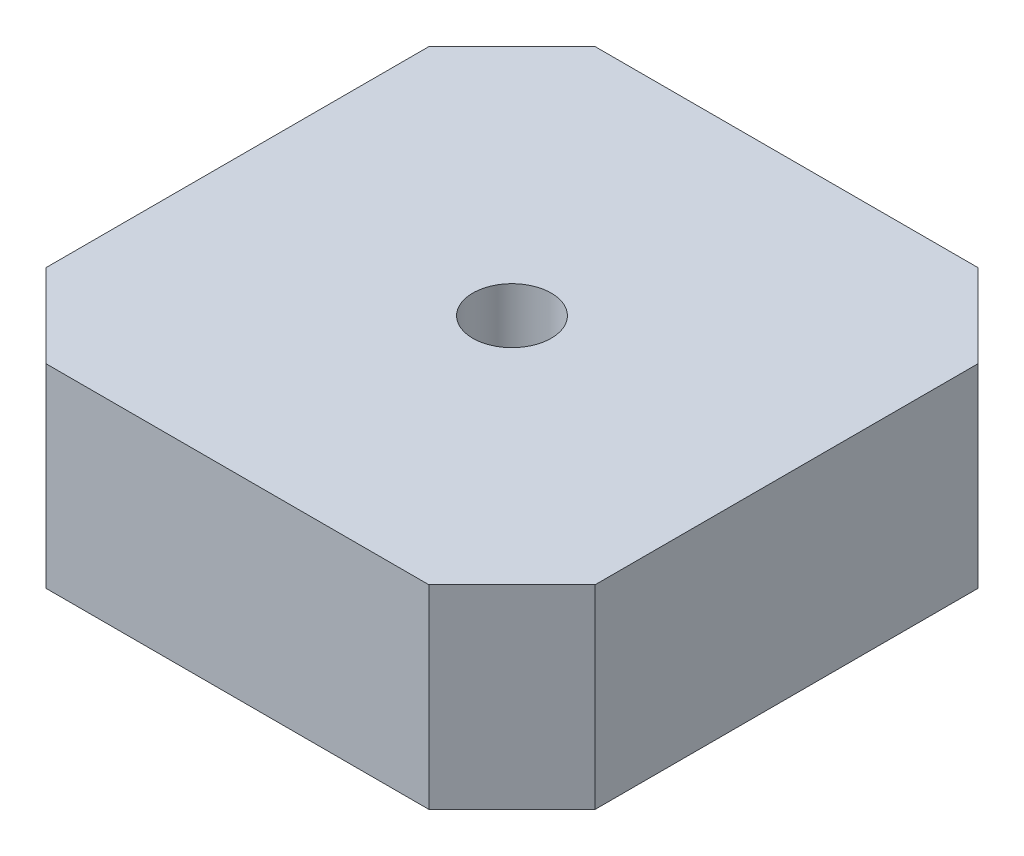
from build123d import *

# Parameters (mm, degrees)
CROQUIS1_W              = 35
CROQUIS1_H              = 35
SALIENTE_EXTRUIR1_DEPTH = 12.4
CROQUIS2_OUTSIDE_W      = 47.206
CROQUIS2_OUTSIDE_H      = 47.206
CORTAR_EXTRUIR2_DEPTH   = 18
CROQUIS3_R              = 2.5
CORTAR_EXTRUIR3_DEPTH   = 52.027051649


with BuildPart() as part:
    # Croquis1 → Saliente-Extruir1 (new body)
    with BuildSketch(Plane(origin=(0, 0, 0), x_dir=(1, 0, 0), z_dir=(0, 1, 0))):
        with Locations((17.5, 17.5)):
            Rectangle(CROQUIS1_W, CROQUIS1_H)
    extrude(amount=SALIENTE_EXTRUIR1_DEPTH)

    # Croquis2 outside → Cortar-Extruir2 (cut)
    with BuildSketch(Plane(origin=(0, 12.4, 0), x_dir=(1, 0, 0), z_dir=(0, 1, 0))):
        with Locations((17.5, 17.5)):
            Rectangle(CROQUIS2_OUTSIDE_W, CROQUIS2_OUTSIDE_H)
        Polygon((5.30151519, 35), (0, 29.69848481), (0, 5.30151519), (5.30151519, 0), (29.69848481, 0), (35, 5.30151519), (35, 29.69848481), (29.69848481, 35), align=None, mode=Mode.SUBTRACT)
    extrude(amount=-CORTAR_EXTRUIR2_DEPTH, mode=Mode.SUBTRACT)

    # Croquis3 → Cortar-Extruir3 (cut, through all)
    with BuildSketch(Plane(origin=(0, 12.4, 0), x_dir=(1, 0, 0), z_dir=(0, 1, 0))):
        with Locations(Location((17.5, 17.5, 0), (0, 0, 270))):
            Circle(CROQUIS3_R)
    extrude(amount=-CORTAR_EXTRUIR3_DEPTH, mode=Mode.SUBTRACT)


solid = part.part
